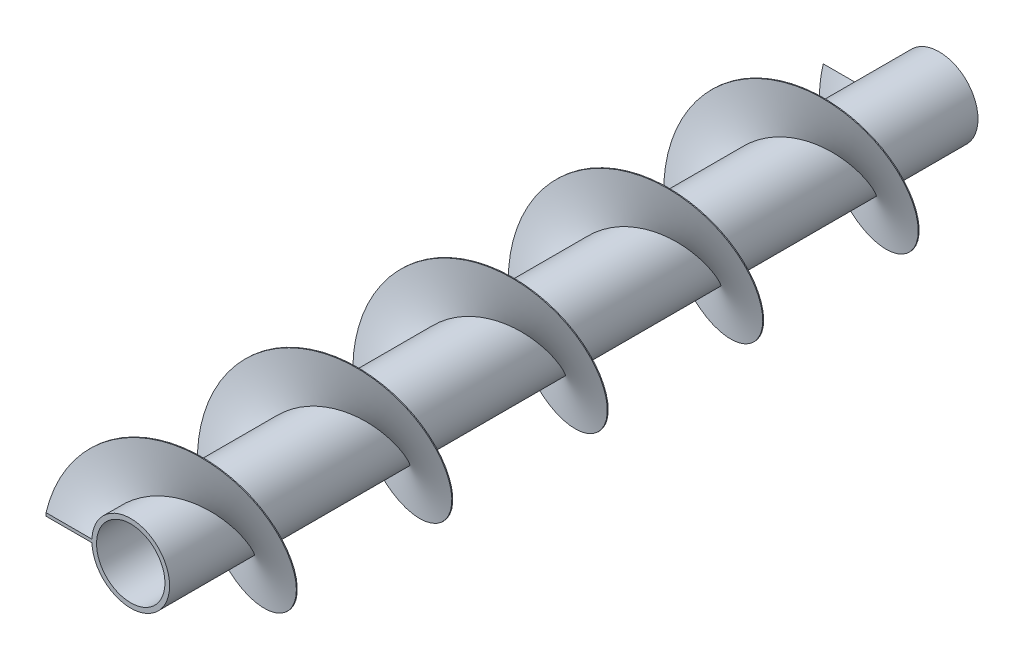
from build123d import *

# Parameters (mm, degrees)
ESBO_O1_R                = 25
ESBO_O1_R_2              = 22
RESSALTO_EXTRUS_O1_DEPTH = 520
VARREDURA1_PITCH         = 100
VARREDURA1_HEIGHT        = 500
VARREDURA1_RADIUS        = 25
VARREDURA1_START_ANGLE   = 90
ESBO_O3_W                = 30
ESBO_O3_H                = 2


with BuildPart() as part:
    # Esboço1 → Ressalto-extrusão1 (new body)
    with BuildSketch(Plane.XY):
        Circle(ESBO_O1_R)
        Circle(ESBO_O1_R_2, mode=Mode.SUBTRACT)
    extrude(amount=RESSALTO_EXTRUS_O1_DEPTH)

    # Varredura1: sweep along a helix
    with BuildLine() as varredura1_path:
        add(Helix(VARREDURA1_PITCH, VARREDURA1_HEIGHT, VARREDURA1_RADIUS, center=(0, 0, 520), direction=(0, 0, -1), mode=Mode.PRIVATE).rotate(Axis((0, 0, 520), (0, 0, -1)), VARREDURA1_START_ANGLE))
    # Esboço3 → Varredura1 (sweep)
    with BuildSketch(Plane.XY.offset(520)):
        with Locations((-39.5, 0)):
            Rectangle(ESBO_O3_W, ESBO_O3_H)
    sweep(path=varredura1_path.line, is_frenet=True)


solid = part.part
